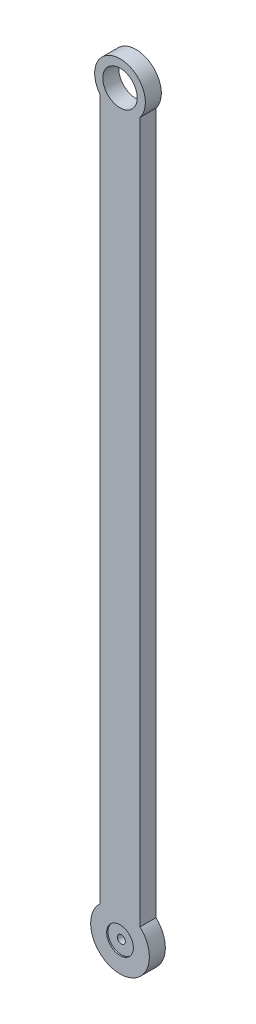
from build123d import *

# Parameters (mm, degrees)
ESQUISSE1_W             = 15
ESQUISSE1_H             = 290
BOSS_EXTRU_1_DEPTH      = 6
ESQUISSE2_R             = 11
ESQUISSE2_R_2           = 9.5
BOSS_EXTRU_2_DEPTH      = 6
ESQUISSE3_R             = 1.5
ESQUISSE3_R_2           = 6.45
ENL_V_MAT_EXTRU_1_DEPTH = 10
ESQUISSE4_R             = 5
ENL_V_MAT_EXTRU_2_DEPTH = 0.5


with BuildPart() as part:
    # Esquisse1 → Boss.-Extru.1 (new body)
    with BuildSketch(Plane.XY):
        with Locations((7.5, 145)):
            Rectangle(ESQUISSE1_W, ESQUISSE1_H)
    extrude(amount=BOSS_EXTRU_1_DEPTH)

    # Esquisse2 → Boss.-Extru.2 (add)
    with BuildSketch(Plane.XY.offset(6)):
        with Locations((7.5, 7.5)):
            Circle(ESQUISSE2_R)
        with Locations((7.5, 284.25)):
            Circle(ESQUISSE2_R_2)
    extrude(amount=-BOSS_EXTRU_2_DEPTH)

    # Esquisse3 → Enlèv. mat.-Extru.1 (cut)
    with BuildSketch(Plane(origin=(0, 0, 0), x_dir=(-1, 0, 0), z_dir=(0, 0, -1))):
        with Locations((-7.5, 7.5)):
            Circle(ESQUISSE3_R)
        with Locations((-7.5, 284.25)):
            Circle(ESQUISSE3_R_2)
    extrude(amount=-ENL_V_MAT_EXTRU_1_DEPTH, mode=Mode.SUBTRACT)

    # Esquisse4 → Enlèv. mat.-Extru.2 (cut)
    with BuildSketch(Plane.XY.offset(6)):
        with Locations((7.5, 7.5)):
            Circle(ESQUISSE4_R)
    extrude(amount=-ENL_V_MAT_EXTRU_2_DEPTH, mode=Mode.SUBTRACT)


solid = part.part
